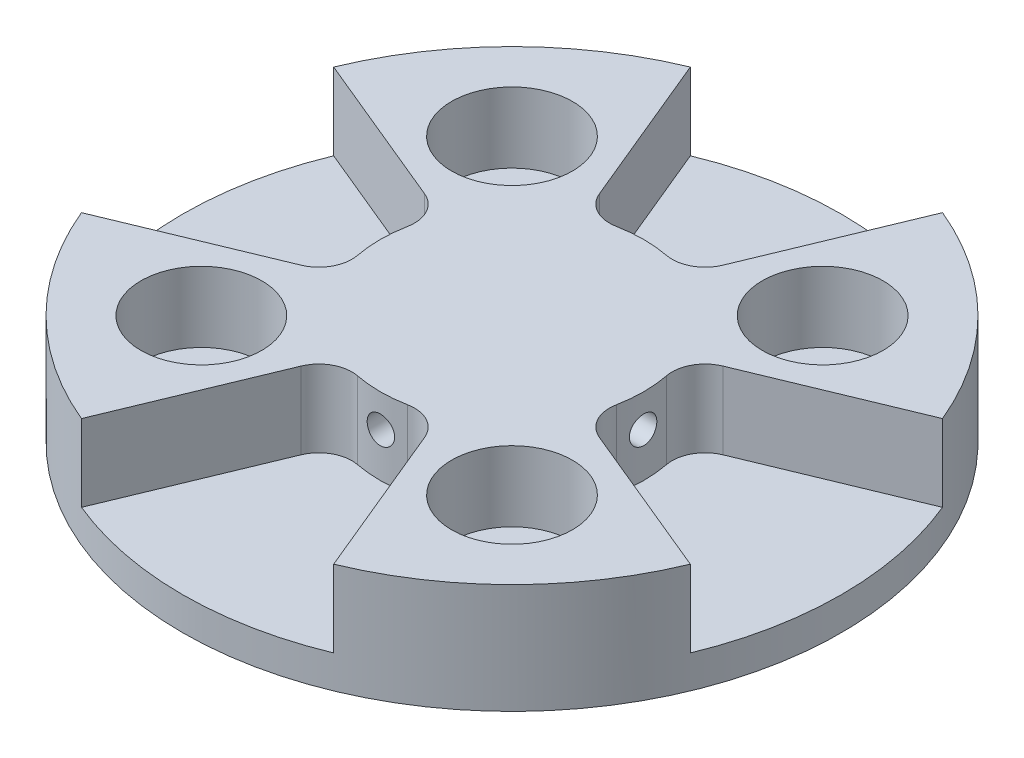
from build123d import *

# Parameters (mm, degrees)
SKETCH1_R                                           = 30
BOSS_EXTRUDE1_DEPTH                                 = 10
CBORE_FOR_M6_HEX_SOCKET_HEAD_CAP_SCREW1_D           = 6.6
CBORE_FOR_M6_HEX_SOCKET_HEAD_CAP_SCREW1_CBORE_D     = 11
CBORE_FOR_M6_HEX_SOCKET_HEAD_CAP_SCREW1_CBORE_DEPTH = 6.4
CUT_EXTRUDE1_START                                  = -7
CUT_EXTRUDE1_DEPTH                                  = 7
CIRPATTERN1_COUNT                                   = 4
FILLET1_R                                           = 3


with BuildPart() as part:
    # Sketch1 → Boss-Extrude1 (new body)
    with BuildSketch(Plane(origin=(0, 0, 0), x_dir=(1, 0, 0), z_dir=(0, 1, 0))):
        with Locations(Location((0, 0, 0), (0, 0, 270))):
            Circle(SKETCH1_R)
    extrude(amount=BOSS_EXTRUDE1_DEPTH)

    # CBORE for M6 Hex Socket Head Cap Screw1 (through all)
    with Locations(Plane(origin=(0, 10, 0), x_dir=(1, 0, 0), z_dir=(0, 1, 0))):
        with Locations((14.142135624, -14.142135624), (14.142135624, 14.142135624), (-14.142135624, 14.142135624), (-14.142135624, -14.142135624)):
            CounterBoreHole(CBORE_FOR_M6_HEX_SOCKET_HEAD_CAP_SCREW1_D / 2, CBORE_FOR_M6_HEX_SOCKET_HEAD_CAP_SCREW1_CBORE_D / 2, CBORE_FOR_M6_HEX_SOCKET_HEAD_CAP_SCREW1_CBORE_DEPTH)

    # Sketch4 → Cut-Extrude1 (cut)
    with BuildSketch(Plane(origin=(0, 10, 0), x_dir=(1, 0, 0), z_dir=(0, 1, 0)).offset(CUT_EXTRUDE1_START)):
        with BuildLine():
            ThreePointArc((4.592201188, -11.08655439), (0, -12), (-4.592201188, -11.08655439))
            Line((-4.592201188, -11.08655439), (-11.480502971, -27.716385975))
            ThreePointArc((-11.480502971, -27.716385975), (0, -30), (11.480502971, -27.716385975))
            Line((11.480502971, -27.716385975), (4.592201188, -11.08655439))
        make_face()
    cut_extrude1 = extrude(amount=CUT_EXTRUDE1_DEPTH, mode=Mode.SUBTRACT)

    # Sketch6 → M3 Tapped Hole1 (revolve, cut)
    with BuildSketch(Plane(origin=(0, 7, 12), x_dir=(0, -1, 0), z_dir=(1, 0, 0))):
        Polygon((0, 0), (0, 12.751075774), (1.25, 12), (1.25, 0), align=None)
    m3_tapped_hole1 = revolve(axis=Axis((0, 7, 18.35), (0, 0, -1)), mode=Mode.SUBTRACT)

    # CirPattern1: Cut-Extrude1, M3 Tapped Hole1 ×4 about axis
    cirpattern1_axis = Axis((0, 10, 0), (0, 1, 0))
    add([cut_extrude1.rotate(cirpattern1_axis, i * 360 / CIRPATTERN1_COUNT) for i in range(1, CIRPATTERN1_COUNT)], mode=Mode.SUBTRACT)
    add([m3_tapped_hole1.rotate(cirpattern1_axis, i * 360 / CIRPATTERN1_COUNT) for i in range(1, CIRPATTERN1_COUNT)], mode=Mode.SUBTRACT)

    # Fillet1
    fillet1_edges = [part.edges().sort_by_distance(p)[0] for p in [
        (-4.592201188, 6.5, 11.08655439),
        (4.592201188, 6.5, 11.08655439),
        (4.592201188, 6.5, -11.08655439),
        (-4.592201188, 6.5, -11.08655439),
        (-11.08655439, 6.5, -4.592201188),
        (-11.08655439, 6.5, 4.592201188),
        (11.08655439, 6.5, 4.592201188),
        (11.08655439, 6.5, -4.592201188),
    ]]
    fillet(fillet1_edges, radius=FILLET1_R)


solid = part.part
